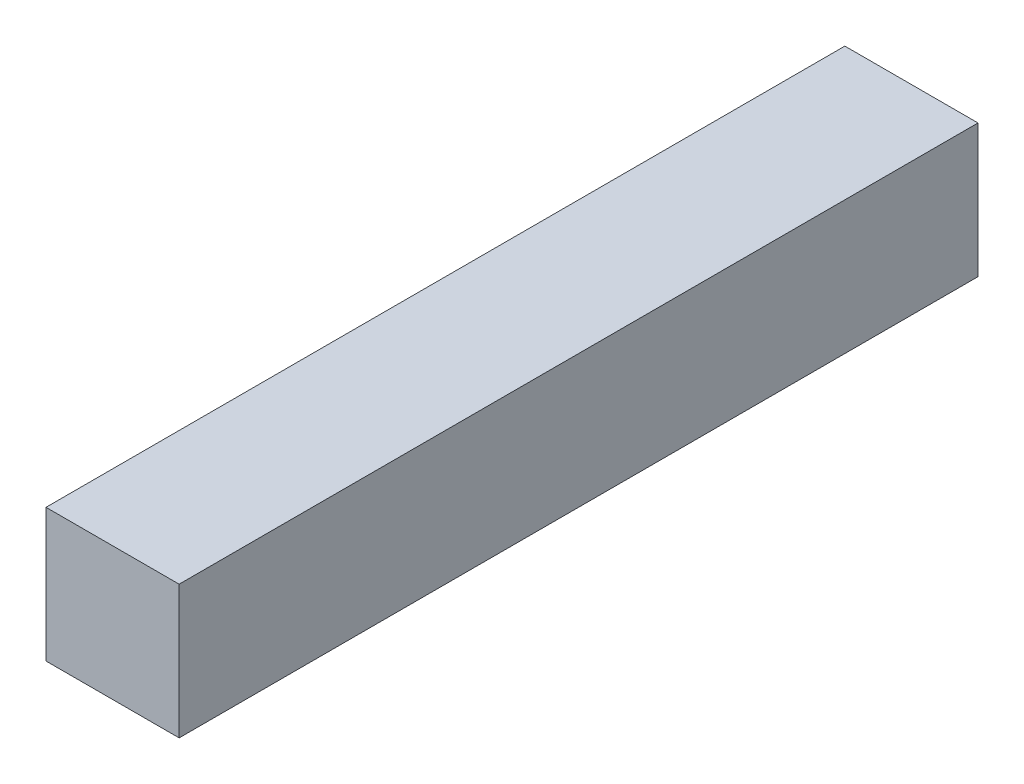
from build123d import *

# Parameters (mm, degrees)
SKETCH1_W           = 20
SKETCH1_H           = 20
BOSS_EXTRUDE1_DEPTH = 120


with BuildPart() as part:
    # Sketch1 → Boss-Extrude1 (new body)
    with BuildSketch(Plane.XY):
        Rectangle(SKETCH1_W, SKETCH1_H)
    extrude(amount=BOSS_EXTRUDE1_DEPTH)


solid = part.part
